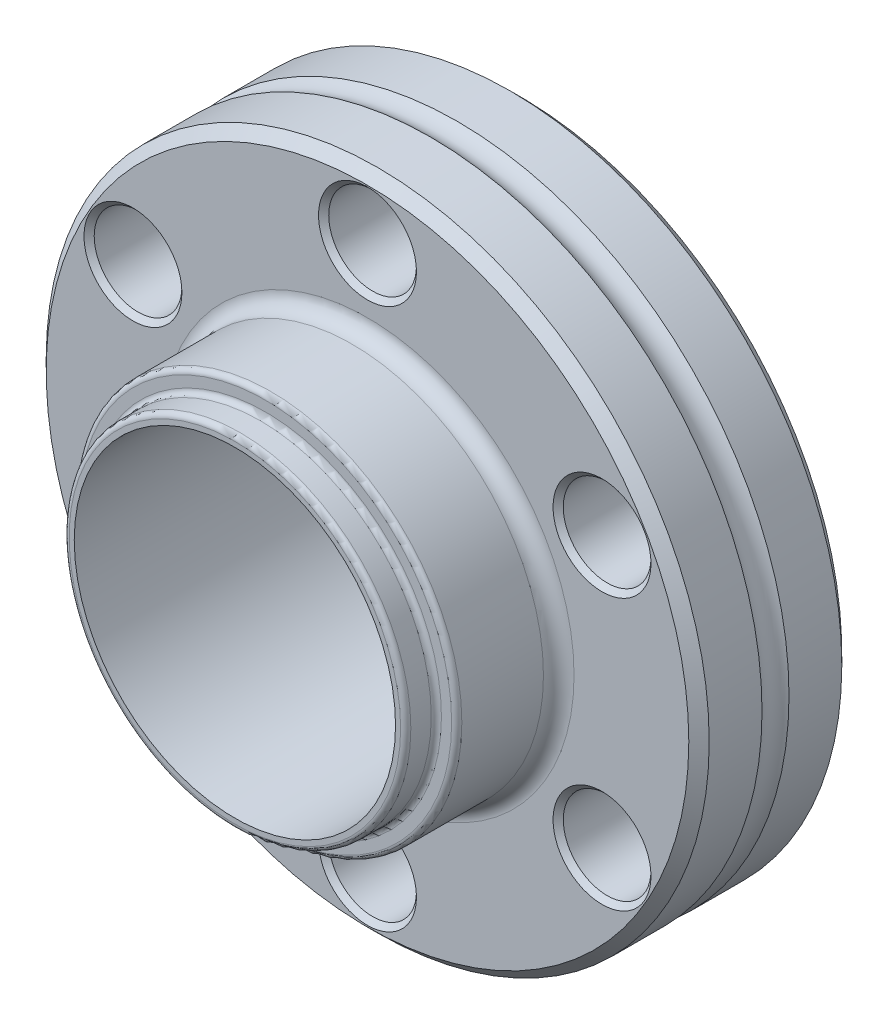
from build123d import *

# Parameters (mm, degrees)
SKETCH2_R                 = 9.525
BOSS_EXTRUDE1_DEPTH       = 5.08
SKETCH3_R                 = 8.509
BOSS_EXTRUDE2_DEPTH       = 1.524
HOLE1_D                   = 16.002
HOLE1_DEPTH               = 14.224
F_8_CLEARANCE_HOLE1_D     = 4.3688
F_8_CLEARANCE_HOLE2_D     = 4.3688
F_8_CLEARANCE_HOLE2_DEPTH = 14.224
CHAMFER1_SIZE             = 0.254
CHAMFER2_SIZE             = 0.508
FILLET1_R                 = 0.254
FILLET2_R                 = 0.762


with BuildPart() as part:
    # Sketch1 → Revolve1 (revolve)
    with BuildSketch(Plane(origin=(0, 0, 0), x_dir=(1, 0, 0), z_dir=(0, 1, 0))):
        with BuildLine():
            Line((9.086103121, 5.9436), (0, 5.9436))
            Line((0, 5.9436), (0, -0.508))
            Line((0, -0.508), (16.51, -0.508))
            Line((16.51, -0.508), (16.51, 2.629979167))
            ThreePointArc((16.51, 2.629979167), (16.256, 3.302), (16.51, 3.974020833))
            Line((16.51, 3.974020833), (16.51, 7.112))
            Line((16.51, 7.112), (10.7315, 7.112))
            Line((10.7315, 7.112), (10.7315, 5.920021473))
            Line((10.7315, 5.920021473), (9.271, 6.4516))
            Line((9.271, 6.4516), (9.086103121, 5.9436))
        make_face()
    revolve(axis=Axis((0, 0, -7.112), (0, 0, 1)))

    # Sketch2 → Boss-Extrude1 (add)
    with BuildSketch(Plane.XY.offset(0.508)):
        Circle(SKETCH2_R)
    extrude(amount=BOSS_EXTRUDE1_DEPTH)

    # Sketch3 → Boss-Extrude2 (add)
    with BuildSketch(Plane.XY.offset(5.588)):
        Circle(SKETCH3_R)
    extrude(amount=BOSS_EXTRUDE2_DEPTH)

    # Hole1
    with Locations(Plane.XY.offset(7.112)):
        with Locations((0, 0)):
            Hole(HOLE1_D / 2, depth=HOLE1_DEPTH)

    # #8 Clearance Hole1 (through all)
    with Locations(Plane.XY.offset(0.508)):
        with Locations((11.680431031, -6.7437)):
            Hole(F_8_CLEARANCE_HOLE1_D / 2)

    # #8 Clearance Hole2
    with Locations(Plane(origin=(0, 0, -7.112), x_dir=(-1, 0, 0), z_dir=(0, 0, -1))):
        with Locations((0, 13.4874), (11.680431031, 6.7437), (11.680431031, -6.7437), (0, -13.4874), (-11.680431031, 6.7437)):
            Hole(F_8_CLEARANCE_HOLE2_D / 2, depth=F_8_CLEARANCE_HOLE2_DEPTH)

    # Chamfer1
    chamfer1_edges = [part.edges().sort_by_distance(p)[0] for p in [
        (13.864831031, -6.7437, 0.508),
        (13.864831031, -6.7437, -7.112),
        (9.496031031, 6.7437, 0.508),
        (9.496031031, 6.7437, -7.112),
        (-2.1844, -13.4874, 0.508),
        (-2.1844, -13.4874, -7.112),
        (-13.864831031, -6.7437, 0.508),
        (-13.864831031, -6.7437, -7.112),
        (-13.864831031, 6.7437, 0.508),
        (-13.864831031, 6.7437, -7.112),
        (-2.1844, 13.4874, 0.508),
        (-2.1844, 13.4874, -7.112),
    ]]
    chamfer(chamfer1_edges, length=CHAMFER1_SIZE)

    # Chamfer2
    chamfer2_edges = [part.edges().sort_by_distance(p)[0] for p in [
        (-16.51, 0, 0.508),
        (-16.51, 0, -7.112),
    ]]
    chamfer(chamfer2_edges, length=CHAMFER2_SIZE)

    # Fillet1
    fillet1_edges = [part.edges().sort_by_distance(p)[0] for p in [
        (-9.525, 0, 5.588),
        (-8.509, 0, 5.588),
        (-8.509, 0, 7.112),
        (8.001, 0, -5.9436),
    ]]
    fillet(fillet1_edges, radius=FILLET1_R)

    # Fillet2
    fillet2_edges = [part.edges().sort_by_distance(p)[0] for p in [
        (-9.525, 0, 0.508),
    ]]
    fillet(fillet2_edges, radius=FILLET2_R)


solid = part.part
